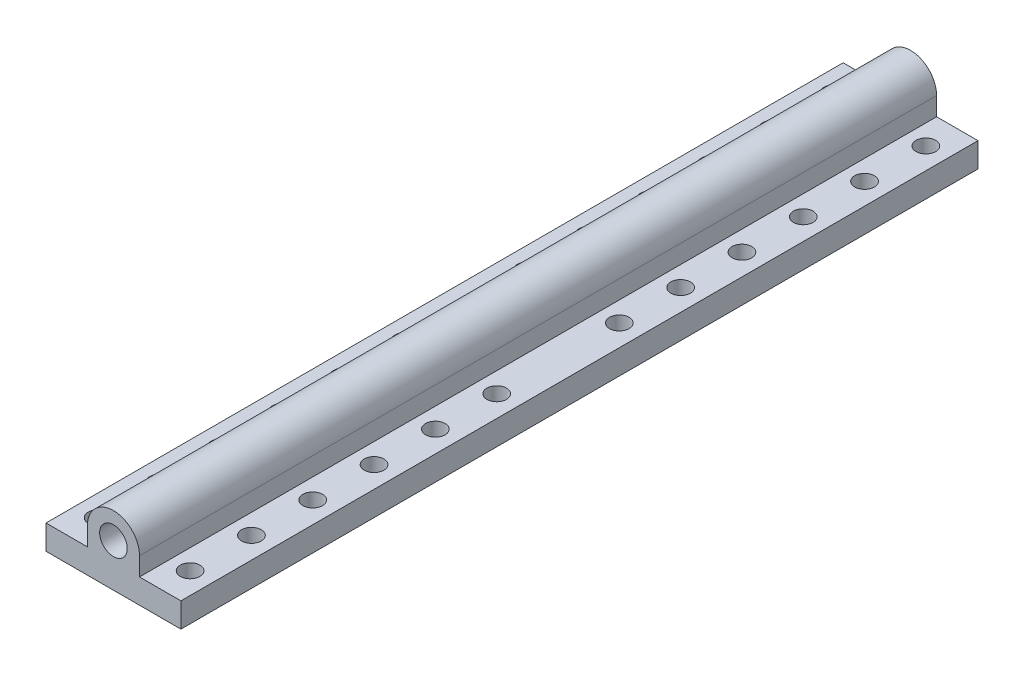
from build123d import *

# Parameters (mm, degrees)
IZIM1_R                     = 2.25
Y_KSEKLIK_EKSTR_ZYON1_DEPTH = 130
IZIM2_R                     = 1.6
KES_EKSTR_ZYON1_DEPTH       = 20


with BuildPart() as part:
    # Çizim1 → Yükseklik-Ekstrüzyon1 (new body)
    with BuildSketch(Plane.XY):
        with BuildLine():
            Line((-9.727729885, 0), (12.272270115, 0))
            Line((12.272270115, 0), (12.272270115, 4))
            Line((12.272270115, 4), (5.522270115, 4))
            Line((5.522270115, 4), (5.522270115, 7))
            ThreePointArc((5.522270115, 7), (1.272270115, 11.25), (-2.977729885, 7))
            Line((-2.977729885, 7), (-2.977729885, 4))
            Line((-2.977729885, 4), (-9.727729885, 4))
            Line((-9.727729885, 4), (-9.727729885, 0))
        make_face()
        with Locations((1.272270115, 7)):
            Circle(IZIM1_R, mode=Mode.SUBTRACT)
    extrude(amount=Y_KSEKLIK_EKSTR_ZYON1_DEPTH)

    # Çizim2 → Kes-Ekstrüzyon1 (cut)
    with BuildSketch(Plane(origin=(0, 8.085148281, 0), x_dir=(1, 0, 0), z_dir=(0, 1, 0))):
        with Locations(Location((8.772270115, -5, 0), (0, 0, 270))):
            Circle(IZIM2_R)
        with Locations(Location((-6.227729885, -5, 0), (0, 0, 270))):
            Circle(IZIM2_R)
        with Locations(Location((-6.227729885, -15, 0), (0, 0, 270))):
            Circle(IZIM2_R)
        with Locations(Location((8.772270115, -15, 0), (0, 0, 270))):
            Circle(IZIM2_R)
        with Locations(Location((8.772270115, -35, 0), (0, 0, 270))):
            Circle(IZIM2_R)
        with Locations(Location((8.772270115, -45, 0), (0, 0, 270))):
            Circle(IZIM2_R)
        with Locations(Location((-6.227729885, -35, 0), (0, 0, 270))):
            Circle(IZIM2_R)
        with Locations(Location((-6.227729885, -45, 0), (0, 0, 270))):
            Circle(IZIM2_R)
        with Locations(Location((-6.227729885, -25, 0), (0, 0, 270))):
            Circle(IZIM2_R)
        with Locations(Location((8.772270115, -25, 0), (0, 0, 270))):
            Circle(IZIM2_R)
        with Locations(Location((-6.227729885, -55, 0), (0, 0, 270))):
            Circle(IZIM2_R)
        with Locations(Location((8.772270115, -55, 0), (0, 0, 270))):
            Circle(IZIM2_R)
        with Locations(Location((8.772270115, -75, 0), (0, 0, 270))):
            Circle(IZIM2_R)
        with Locations(Location((-6.227729885, -75, 0), (0, 0, 270))):
            Circle(IZIM2_R)
        with Locations(Location((8.772270115, -105, 0), (0, 0, 270))):
            Circle(IZIM2_R)
        with Locations(Location((-6.227729885, -105, 0), (0, 0, 270))):
            Circle(IZIM2_R)
        with Locations(Location((-6.227729885, -85, 0), (0, 0, 270))):
            Circle(IZIM2_R)
        with Locations(Location((-6.227729885, -95, 0), (0, 0, 270))):
            Circle(IZIM2_R)
        with Locations(Location((8.772270115, -85, 0), (0, 0, 270))):
            Circle(IZIM2_R)
        with Locations(Location((8.772270115, -95, 0), (0, 0, 270))):
            Circle(IZIM2_R)
        with Locations(Location((8.772270115, -115, 0), (0, 0, 270))):
            Circle(IZIM2_R)
        with Locations(Location((-6.227729885, -115, 0), (0, 0, 270))):
            Circle(IZIM2_R)
        with Locations(Location((-6.227729885, -125, 0), (0, 0, 270))):
            Circle(IZIM2_R)
        with Locations(Location((8.772270115, -125, 0), (0, 0, 270))):
            Circle(IZIM2_R)
    extrude(amount=-KES_EKSTR_ZYON1_DEPTH, mode=Mode.SUBTRACT)


solid = part.part
